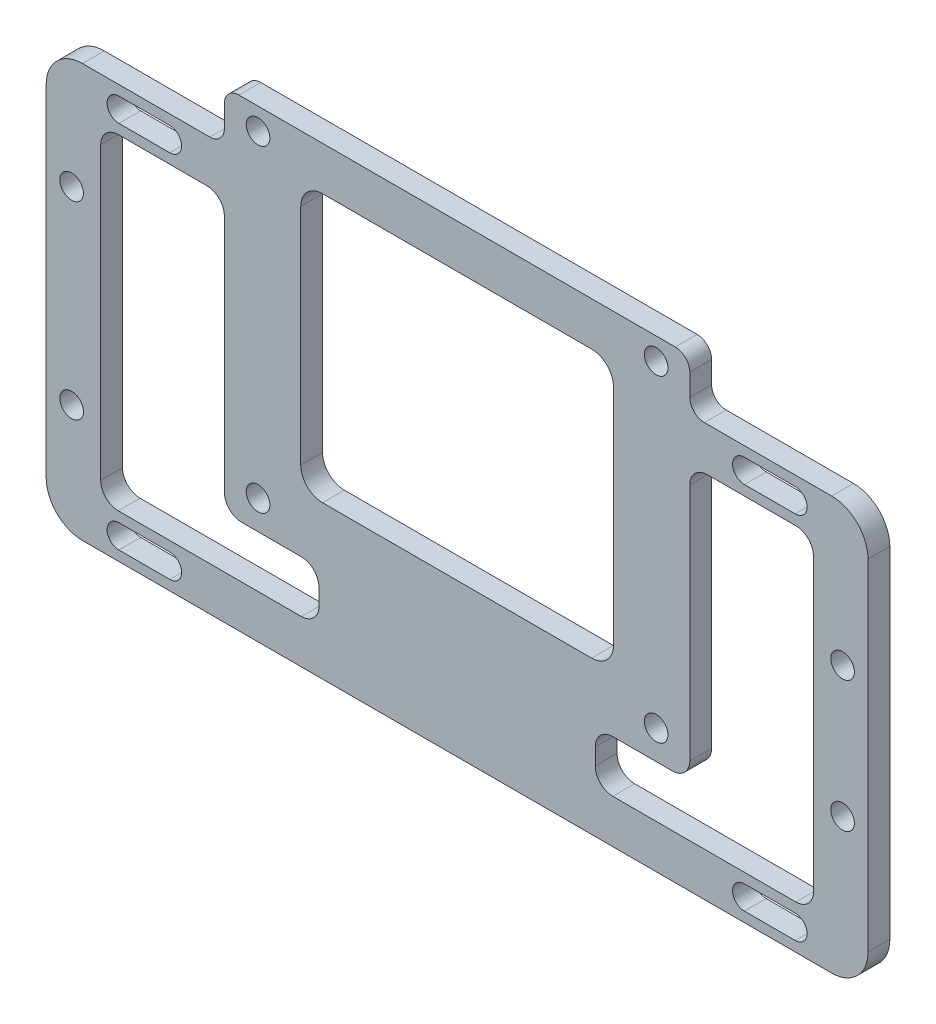
from build123d import *

# Parameters (mm, degrees)
EXTRUDE_2_DEPTH     = 3
SKETCH_5_R          = 1.625
CUT_EXTRUDE_3_DEPTH = 3


with BuildPart() as part:
    # 草图1 → 凸台-拉伸2 (new body)
    with BuildSketch(Plane.XY):
        with BuildLine():
            Line((-53.814137931, 0), (49.185862069, 0))
            ThreePointArc((49.185862069, 0), (52.721395975, 1.464466094), (54.185862069, 5))
            Line((54.185862069, 5), (54.185862069, 51.8))
            ThreePointArc((54.185862069, 51.8), (52.721395975, 55.335533906), (49.185862069, 56.8))
            Line((49.185862069, 56.8), (31.685862069, 56.8))
            ThreePointArc((31.685862069, 56.8), (30.271648507, 57.385786438), (29.685862069, 58.8))
            Line((29.685862069, 58.8), (29.685862069, 61.8))
            ThreePointArc((29.685862069, 61.8), (29.100075631, 63.214213562), (27.685862069, 63.8))
            Line((27.685862069, 63.8), (-32.314137931, 63.8))
            ThreePointArc((-32.314137931, 63.8), (-33.728351493, 63.214213562), (-34.314137931, 61.8))
            Line((-34.314137931, 61.8), (-34.314137931, 58.8))
            ThreePointArc((-34.314137931, 58.8), (-34.899924369, 57.385786438), (-36.314137931, 56.8))
            Line((-36.314137931, 56.8), (-53.814137931, 56.8))
            ThreePointArc((-53.814137931, 56.8), (-57.349671837, 55.335533906), (-58.814137931, 51.8))
            Line((-58.814137931, 51.8), (-58.814137931, 5))
            ThreePointArc((-58.814137931, 5), (-57.349671837, 1.464466094), (-53.814137931, 0))
        make_face()
    extrude(amount=EXTRUDE_2_DEPTH)

    # 草图5 → 切除-拉伸3 (cut)
    with BuildSketch(Plane.XY.offset(3)):
        with Locations((-29.684137931, 60.8)):
            Circle(SKETCH_5_R)
        with Locations((25.055862069, 60.8)):
            Circle(SKETCH_5_R)
        with Locations((-29.684137931, 17.11)):
            Circle(SKETCH_5_R)
        with Locations((25.055862069, 17.11)):
            Circle(SKETCH_5_R)
        with Locations((-55.314137931, 15.4)):
            Circle(SKETCH_5_R)
        with Locations((-55.314137931, 41.4)):
            Circle(SKETCH_5_R)
        with Locations((50.685862069, 37.4)):
            Circle(SKETCH_5_R)
        with Locations((50.685862069, 19.4)):
            Circle(SKETCH_5_R)
        with BuildLine():
            Line((-48.906226665, 50.8), (-36.722049198, 50.8))
            ThreePointArc((-36.722049198, 50.8), (-35.019398812, 50.094739119), (-34.314137931, 48.392088734))
            Line((-34.314137931, 48.392088734), (-34.314137931, 15.517911266))
            ThreePointArc((-34.314137931, 15.517911266), (-33.60887705, 13.815260881), (-31.906226665, 13.11))
            Line((-31.906226665, 13.11), (-23.722049198, 13.11))
            ThreePointArc((-23.722049198, 13.11), (-22.019398812, 12.404739119), (-21.314137931, 10.702088734))
            Line((-21.314137931, 10.702088734), (-21.314137931, 8.407911266))
            ThreePointArc((-21.314137931, 8.407911266), (-22.019398812, 6.705260881), (-23.722049198, 6))
            Line((-23.722049198, 6), (-48.906226665, 6))
            ThreePointArc((-48.906226665, 6), (-50.60887705, 6.705260881), (-51.314137931, 8.407911266))
            Line((-51.314137931, 8.407911266), (-51.314137931, 48.392088734))
            ThreePointArc((-51.314137931, 48.392088734), (-50.60887705, 50.094739119), (-48.906226665, 50.8))
        make_face()
        with BuildLine():
            Line((-48.814137931, 4.625), (-41.814137931, 4.625))
            ThreePointArc((-41.814137931, 4.625), (-40.189137931, 3), (-41.814137931, 1.375))
            Line((-41.814137931, 1.375), (-48.814137931, 1.375))
            ThreePointArc((-48.814137931, 1.375), (-50.439137931, 3), (-48.814137931, 4.625))
        make_face()
        with BuildLine():
            Line((37.185862069, 4.625), (44.185862069, 4.625))
            ThreePointArc((44.185862069, 4.625), (45.810862069, 3), (44.185862069, 1.375))
            Line((44.185862069, 1.375), (37.185862069, 1.375))
            ThreePointArc((37.185862069, 1.375), (35.560862069, 3), (37.185862069, 4.625))
        make_face()
        with BuildLine():
            Line((-48.814137931, 55.425), (-41.814137931, 55.425))
            ThreePointArc((-41.814137931, 55.425), (-40.189137931, 53.8), (-41.814137931, 52.175))
            Line((-41.814137931, 52.175), (-48.814137931, 52.175))
            ThreePointArc((-48.814137931, 52.175), (-50.439137931, 53.8), (-48.814137931, 55.425))
        make_face()
        with BuildLine():
            Line((37.185862069, 55.425), (44.185862069, 55.425))
            ThreePointArc((44.185862069, 55.425), (45.810862069, 53.8), (44.185862069, 52.175))
            Line((44.185862069, 52.175), (37.185862069, 52.175))
            ThreePointArc((37.185862069, 52.175), (35.560862069, 53.8), (37.185862069, 55.425))
        make_face()
        with BuildLine():
            Line((29.685862069, 48.392088734), (29.685862069, 15.517911266))
            ThreePointArc((29.685862069, 15.517911266), (28.980601188, 13.815260881), (27.277950802, 13.11))
            Line((27.277950802, 13.11), (19.093773335, 13.11))
            ThreePointArc((19.093773335, 13.11), (17.39112295, 12.404739119), (16.685862069, 10.702088734))
            Line((16.685862069, 10.702088734), (16.685862069, 8.407911266))
            ThreePointArc((16.685862069, 8.407911266), (17.39112295, 6.705260881), (19.093773335, 6))
            Line((19.093773335, 6), (44.277950802, 6))
            ThreePointArc((44.277950802, 6), (45.980601188, 6.705260881), (46.685862069, 8.407911266))
            Line((46.685862069, 8.407911266), (46.685862069, 48.392088734))
            ThreePointArc((46.685862069, 48.392088734), (45.980601188, 50.094739119), (44.277950802, 50.8))
            Line((44.277950802, 50.8), (32.093773335, 50.8))
            ThreePointArc((32.093773335, 50.8), (30.39112295, 50.094739119), (29.685862069, 48.392088734))
        make_face()
        with BuildLine():
            Line((-23.814137931, 54.8), (-23.814137931, 24))
            ThreePointArc((-23.814137931, 24), (-22.935458275, 21.878679656), (-20.814137931, 21))
            Line((-20.814137931, 21), (16.185862069, 21))
            ThreePointArc((16.185862069, 21), (18.307182413, 21.878679656), (19.185862069, 24))
            Line((19.185862069, 24), (19.185862069, 54.8))
            ThreePointArc((19.185862069, 54.8), (18.307182413, 56.921320344), (16.185862069, 57.8))
            Line((16.185862069, 57.8), (-20.814137931, 57.8))
            ThreePointArc((-20.814137931, 57.8), (-22.935458275, 56.921320344), (-23.814137931, 54.8))
        make_face()
    extrude(amount=-CUT_EXTRUDE_3_DEPTH, mode=Mode.SUBTRACT)


solid = part.part
